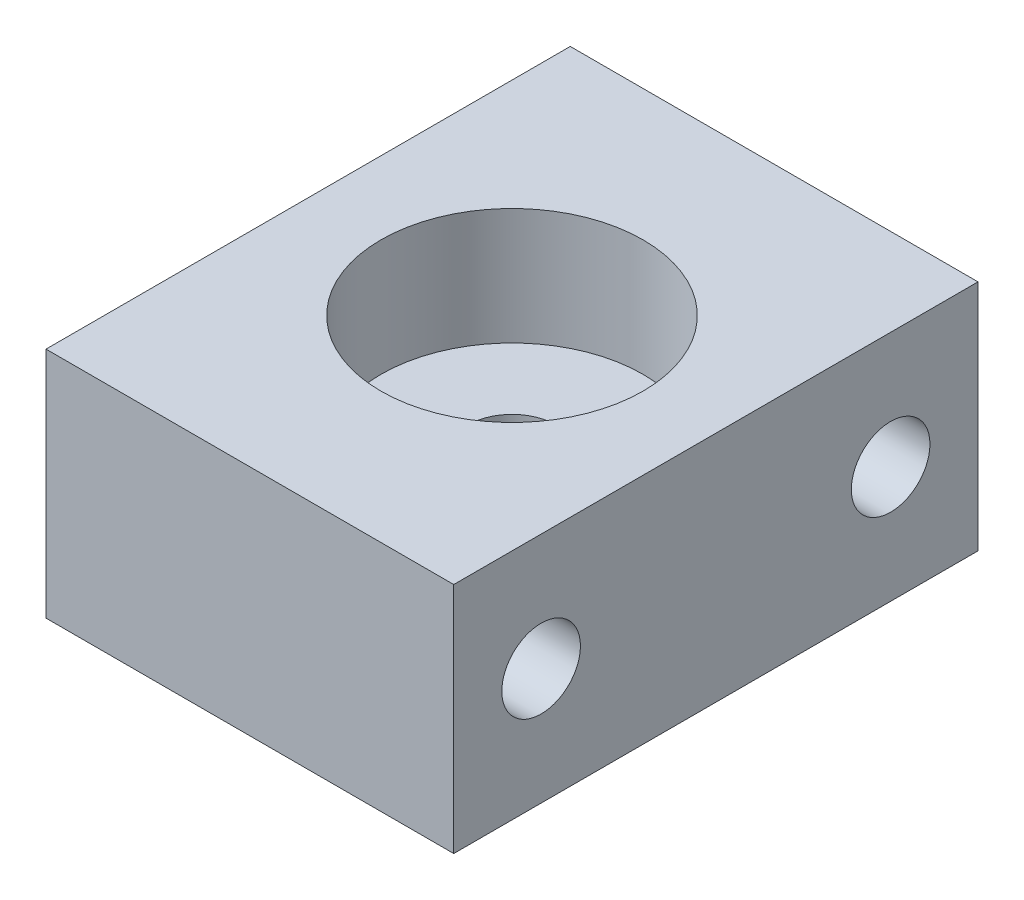
from build123d import *

# Parameters (mm, degrees)
SKETCH_2_W               = 14
SKETCH_2_H               = 8
EXTRUDE_2_DEPTH          = 9
CUT_EXTRUDE_1_DEPTH      = 13.083045974
CUT_EXTRUDE_1_DEPTH_BACK = 13.083045974
SKETCH_3_R               = 1.35
SKETCH_3_2_R             = 1.35
EXTRUDE_3_DEPTH          = 3
SKETCH_6_R               = 1.5
CUT_EXTRUDE_3_DEPTH      = 10
SKETCH_7_R               = 4.5
CUT_EXTRUDE_4_DEPTH      = 4


with BuildPart() as part:
    # 草图2 → 凸台-拉伸2 (new, symmetric)
    with BuildSketch(Plane.XY):
        Rectangle(SKETCH_2_W, SKETCH_2_H)
    extrude(amount=EXTRUDE_2_DEPTH, both=True)

    # 草图3 → 切除-拉伸1 (cut, two sides: drawn at the far end of the back side and taken through both)
    with BuildSketch(Plane(origin=(0, 0, 0), x_dir=(0, 0, -1), z_dir=(1, 0, 0)).offset(-CUT_EXTRUDE_1_DEPTH_BACK)):
        with Locations((6, 0)):
            Circle(SKETCH_3_R)
        with Locations((-6, 0)):
            Circle(SKETCH_3_R)
    extrude(amount=CUT_EXTRUDE_1_DEPTH + CUT_EXTRUDE_1_DEPTH_BACK, mode=Mode.SUBTRACT)

    # 草图3<2> → 凸台-拉伸3 (add, symmetric)
    with BuildSketch(Plane(origin=(0, 0, 0), x_dir=(0, 0, -1), z_dir=(1, 0, 0))):
        with Locations((6, 0)):
            Circle(SKETCH_3_2_R)
        with Locations((-6, 0)):
            Circle(SKETCH_3_2_R)
    extrude(amount=EXTRUDE_3_DEPTH, both=True)

    # 草图6 → 切除-拉伸3 (cut)
    with BuildSketch(Plane.XZ.offset(4)):
        Circle(SKETCH_6_R)
    extrude(amount=-CUT_EXTRUDE_3_DEPTH, mode=Mode.SUBTRACT)

    # 草图7 → 切除-拉伸4 (cut)
    with BuildSketch(Plane.XZ.offset(-4)):
        Circle(SKETCH_7_R)
    extrude(amount=CUT_EXTRUDE_4_DEPTH, mode=Mode.SUBTRACT)


solid = part.part
